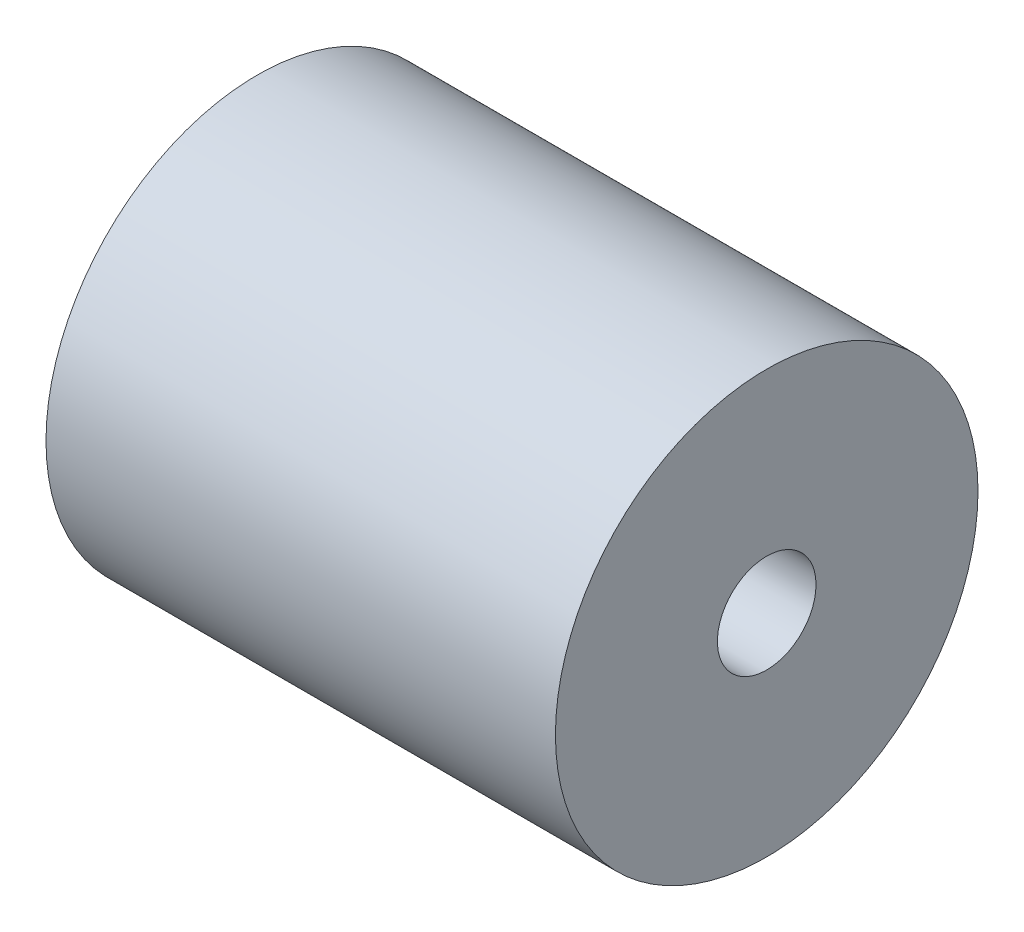
from build123d import *

# Parameters (mm, degrees)
SKETCH1_R           = 9
SKETCH1_R_2         = 2.1
BOSS_EXTRUDE1_DEPTH = 21.7


with BuildPart() as part:
    # Sketch1 → Boss-Extrude1 (new body)
    with BuildSketch(Plane(origin=(0, 0, 0), x_dir=(0, 0, -1), z_dir=(1, 0, 0))):
        Circle(SKETCH1_R)
        Circle(SKETCH1_R_2, mode=Mode.SUBTRACT)
    extrude(amount=BOSS_EXTRUDE1_DEPTH)


solid = part.part
